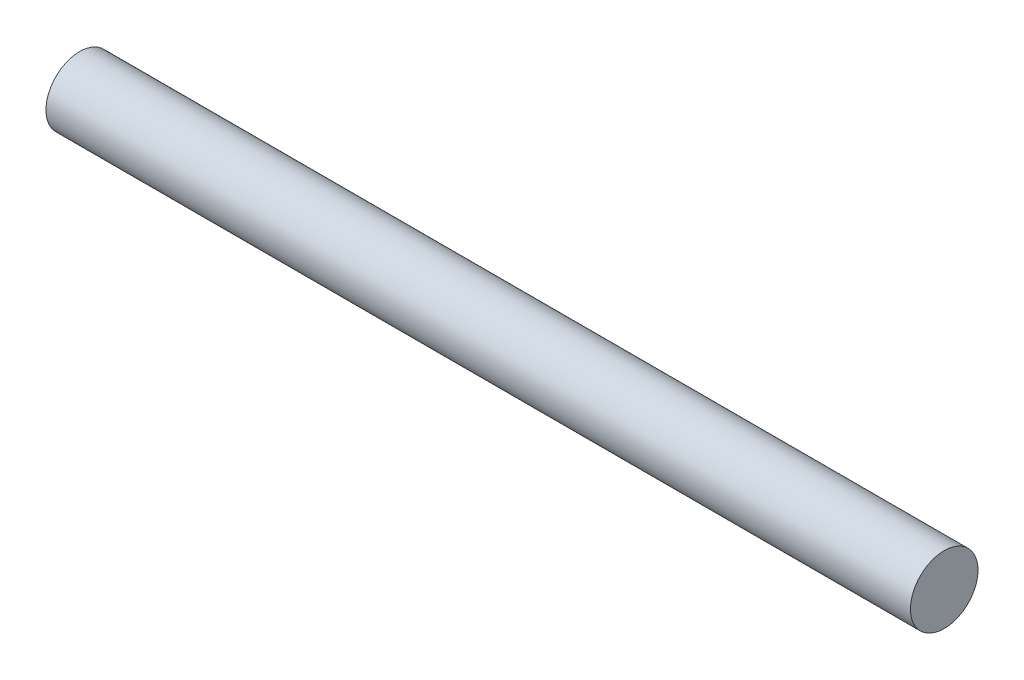
from build123d import *

# Parameters (mm, degrees)
SKETCH_1_R      = 12.5
EXTRUDE_1_DEPTH = 320


with BuildPart() as part:
    # 草图1 → 凸台-拉伸1 (new body)
    with BuildSketch(Plane(origin=(0, 0, 0), x_dir=(0, 0, -1), z_dir=(1, 0, 0))):
        Circle(SKETCH_1_R)
    extrude(amount=EXTRUDE_1_DEPTH)


solid = part.part
